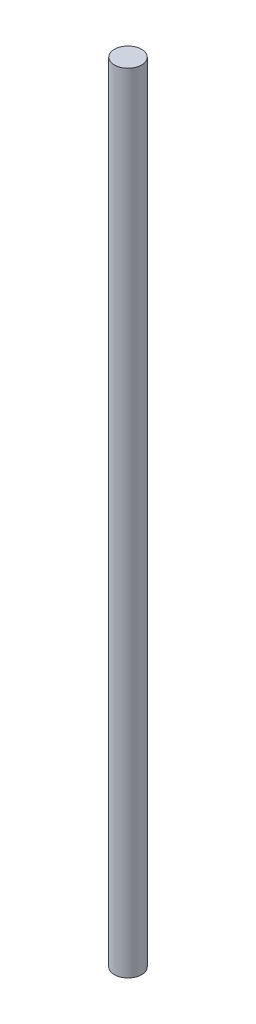
from build123d import *

# Parameters (mm, degrees)
SKETCH1_R           = 2.25
BOSS_EXTRUDE1_DEPTH = 130


with BuildPart() as part:
    # Sketch1 → Boss-Extrude1 (new body)
    with BuildSketch(Plane(origin=(0, 0, 0), x_dir=(1, 0, 0), z_dir=(0, 1, 0))):
        with Locations(Location((0, 0, 0), (0, 0, 270))):
            Circle(SKETCH1_R)
    extrude(amount=BOSS_EXTRUDE1_DEPTH)


solid = part.part
